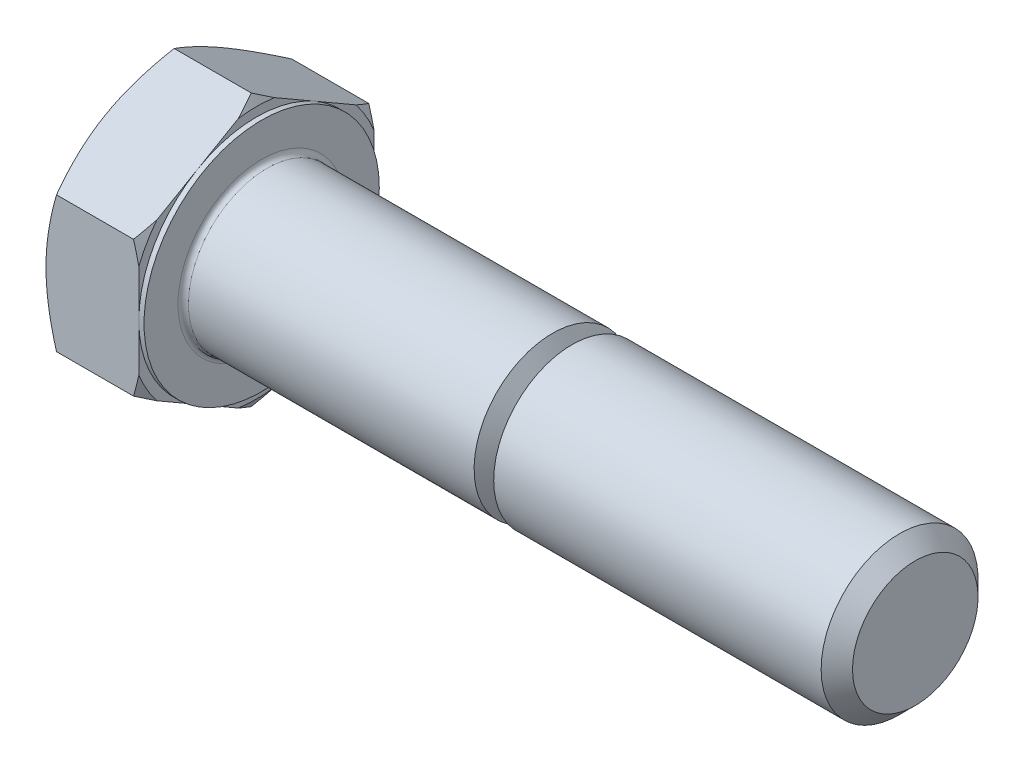
from build123d import *

# Parameters (mm, degrees)
EXTRUDE_384_DEPTH = 15
SKETCH_4_W        = 0.8
SKETCH_4_H        = 12.784609691
CHAMFER_2079_SIZE = 2.4
FILLET_2121_R     = 0.8


with BuildPart() as part:
    # 草图1 → Extrude 384 (new body)
    with BuildSketch(Plane(origin=(0, 0, 0), x_dir=(0, 0, -1), z_dir=(1, 0, 0))):
        Polygon((18, 10.392304845), (18, -10.392304845), (0, -20.784609691), (-18, -10.392304845), (-18, 10.392304845), (0, 20.784609691), align=None)
    extrude(amount=EXTRUDE_384_DEPTH)

    # 草图2 → 凸台-旋转1 (revolve)
    with BuildSketch(Plane.XY, mode=Mode.PRIVATE) as revolve_1_sk:
        Polygon((0, 0), (115, 0), (115, 9.402), (115, 12), (27.8072, 12), (0, 12), align=None)
    revolve(revolve_1_sk.sketch.rotate(Axis((0, 0, 0), (1, 0, 0)), 90), axis=Axis((0, 0, 0), (1, 0, 0)))

    # 草图3 → 切除-旋转1 (revolve, cut)
    with BuildSketch(Plane.XY):
        Polygon((0, 18), (4.494446501, 25.784609691), (4.494446501, 30.784609691), (-10, 30.784609691), (-10, 18), align=None)
    revolve(axis=Axis((0, 0, 0), (1, 0, 0)), mode=Mode.SUBTRACT)

    # 草图5 → 切除-旋转2 (revolve, cut)
    with BuildSketch(Plane.XY):
        Polygon((15, 18), (10.505553499, 25.784609691), (10.505553499, 30.784609691), (20.505553499, 30.784609691), (20.505553499, 18), align=None)
    revolve(axis=Axis((0, 0, 0), (1, 0, 0)), mode=Mode.SUBTRACT)

    # 草图4 → 切除-旋转3 (revolve, cut)
    with BuildSketch(Plane.XY, mode=Mode.PRIVATE) as cut_revolve_3_sk:
        with Locations((14.6, 24.392304845)):
            Rectangle(SKETCH_4_W, SKETCH_4_H)
    revolve(cut_revolve_3_sk.sketch.rotate(Axis((0, 0, 0), (1, 0, 0)), 270), axis=Axis((0, 0, 0), (1, 0, 0)), mode=Mode.SUBTRACT)

    # Chamfer 2079
    chamfer_2079_edges = [part.edges().sort_by_distance(p)[0] for p in [
        (115, 0, -12),
    ]]
    chamfer(chamfer_2079_edges, length=CHAMFER_2079_SIZE)

    # Fillet 2121
    fillet_2121_edges = [part.edges().sort_by_distance(p)[0] for p in [
        (15, 0, -12),
    ]]
    fillet(fillet_2121_edges, radius=FILLET_2121_R)

    # 草图6 → 切除-旋转4 (revolve, cut)
    with BuildSketch(Plane.XY):
        Polygon((61, -9.402), (59.500044001, -12), (59.500044001, -15), (62.499955999, -15), (62.499955999, -12), align=None)
    revolve(axis=Axis((-3.175, 0, 0), (1, 0, 0)), mode=Mode.SUBTRACT)


solid = part.part
